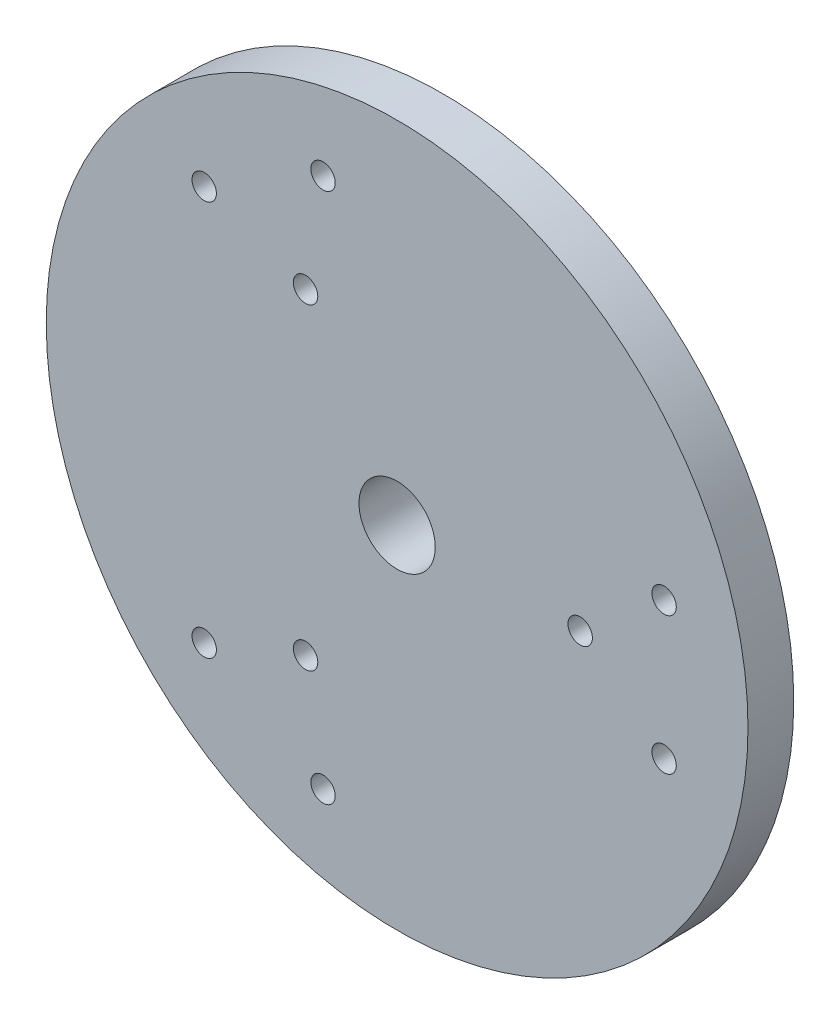
from build123d import *

# Parameters (mm, degrees)
EXTRUDE_START       = 18
SKETCH_1_R          = 46
EXTRUDE_1_DEPTH     = 6
EXTRUDE_START_2     = 12
SKETCH_2_R          = 14
EXTRUDE_2_DEPTH     = 6
SKETCH_3_R          = 1.6
CUT_EXTRUDE_2_DEPTH = 89.746830929
SKETCH_4_R          = 5
CUT_EXTRUDE_4_DEPTH = 89.746830929


with BuildPart() as part:
    # 草图1 → 凸台-拉伸1 (new body)
    with BuildSketch(Plane.XY.offset(EXTRUDE_START)):
        with Locations((0, 26)):
            Circle(SKETCH_1_R)
    extrude(amount=EXTRUDE_1_DEPTH)

    # 草图2 → 凸台-拉伸2 (add)
    with BuildSketch(Plane.XY.offset(EXTRUDE_START_2)):
        with Locations((0, 26)):
            Circle(SKETCH_2_R)
    extrude(amount=EXTRUDE_2_DEPTH)

    # 草图3 → 切除-拉伸2 (cut, through all)
    with BuildSketch(Plane.XY):
        with Locations((24, 26)):
            Circle(SKETCH_3_R)
        with Locations((35, 35)):
            Circle(SKETCH_3_R)
        with Locations((35, 17)):
            Circle(SKETCH_3_R)
        with Locations((-12, 46.78)):
            Circle(SKETCH_3_R)
        with Locations((-25.29, 51.81)):
            Circle(SKETCH_3_R)
        with Locations((-9.71, 60.81)):
            Circle(SKETCH_3_R)
        with Locations((-12, 5.22)):
            Circle(SKETCH_3_R)
        with Locations((-9.71, -8.81)):
            Circle(SKETCH_3_R)
        with Locations((-25.29, 0)):
            Circle(SKETCH_3_R)
    extrude(amount=CUT_EXTRUDE_2_DEPTH, mode=Mode.SUBTRACT)

    # 草图4 → 切除-拉伸4 (cut, through all)
    with BuildSketch(Plane.XY):
        with Locations((0, 26)):
            Circle(SKETCH_4_R)
    extrude(amount=CUT_EXTRUDE_4_DEPTH, mode=Mode.SUBTRACT)


solid = part.part
